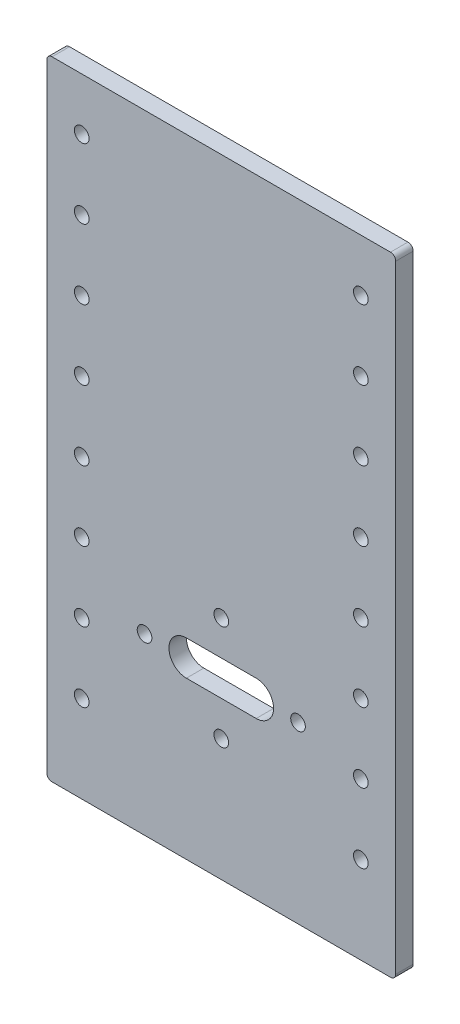
from build123d import *

# Parameters (mm, degrees)
SKETCH1_W           = 100
SKETCH1_H           = 180
BOSS_EXTRUDE1_DEPTH = 5
SKETCH2_R           = 2.1
CUT_EXTRUDE1_DEPTH  = 104.07764064
FILLET1_R           = 1.5
SKETCH3_R           = 2.1
CUT_EXTRUDE2_DEPTH  = 104.07764064


with BuildPart() as part:
    # Sketch1 → Boss-Extrude1 (new body)
    with BuildSketch(Plane.XY):
        Rectangle(SKETCH1_W, SKETCH1_H)
    extrude(amount=BOSS_EXTRUDE1_DEPTH)

    # Sketch2 → Cut-Extrude1 (cut, through all)
    with BuildSketch(Plane(origin=(0, 0, 0), x_dir=(-1, 0, 0), z_dir=(0, 0, -1))):
        with Locations((-22, -40)):
            Circle(SKETCH2_R)
        with Locations((0, -25)):
            Circle(SKETCH2_R)
        with Locations(Location((22, -40, 0), (0, 0, 180))):
            Circle(SKETCH2_R)
        with Locations(Location((0, -55, 0), (0, 0, 180))):
            Circle(SKETCH2_R)
        with BuildLine():
            Line((-10, -35), (10, -35))
            ThreePointArc((10, -35), (15, -40), (10, -45))
            Line((10, -45), (-10, -45))
            ThreePointArc((-10, -45), (-15, -40), (-10, -35))
        make_face()
    extrude(amount=-CUT_EXTRUDE1_DEPTH, mode=Mode.SUBTRACT)

    # Fillet1
    fillet1_edges = [part.edges().sort_by_distance(p)[0] for p in [
        (50, -90, 2.5),
        (-50, -90, 2.5),
        (-50, 90, 2.5),
        (50, 90, 2.5),
    ]]
    fillet(fillet1_edges, radius=FILLET1_R)

    # Sketch3 → Cut-Extrude2 (cut, through all)
    with BuildSketch(Plane(origin=(0, 0, 0), x_dir=(-1, 0, 0), z_dir=(0, 0, -1))):
        with Locations((-40, 75)):
            Circle(SKETCH3_R)
        with Locations((-40, 55)):
            Circle(SKETCH3_R)
        with Locations((-40, 35)):
            Circle(SKETCH3_R)
        with Locations((-40, 15)):
            Circle(SKETCH3_R)
        with Locations((-40, -5)):
            Circle(SKETCH3_R)
        with Locations(Location((40, -5, 0), (0, 0, 180))):
            Circle(SKETCH3_R)
        with Locations(Location((40, 15, 0), (0, 0, 180))):
            Circle(SKETCH3_R)
        with Locations(Location((40, 35, 0), (0, 0, 180))):
            Circle(SKETCH3_R)
        with Locations(Location((40, 75, 0), (0, 0, 180))):
            Circle(SKETCH3_R)
        with Locations(Location((40, 55, 0), (0, 0, 180))):
            Circle(SKETCH3_R)
        with Locations((-40, -25)):
            Circle(SKETCH3_R)
        with Locations((-40, -45)):
            Circle(SKETCH3_R)
        with Locations((-40, -65)):
            Circle(SKETCH3_R)
        with Locations(Location((40, -65, 0), (0, 0, 180))):
            Circle(SKETCH3_R)
        with Locations(Location((40, -45, 0), (0, 0, 180))):
            Circle(SKETCH3_R)
        with Locations(Location((40, -25, 0), (0, 0, 180))):
            Circle(SKETCH3_R)
    extrude(amount=-CUT_EXTRUDE2_DEPTH, mode=Mode.SUBTRACT)


solid = part.part
